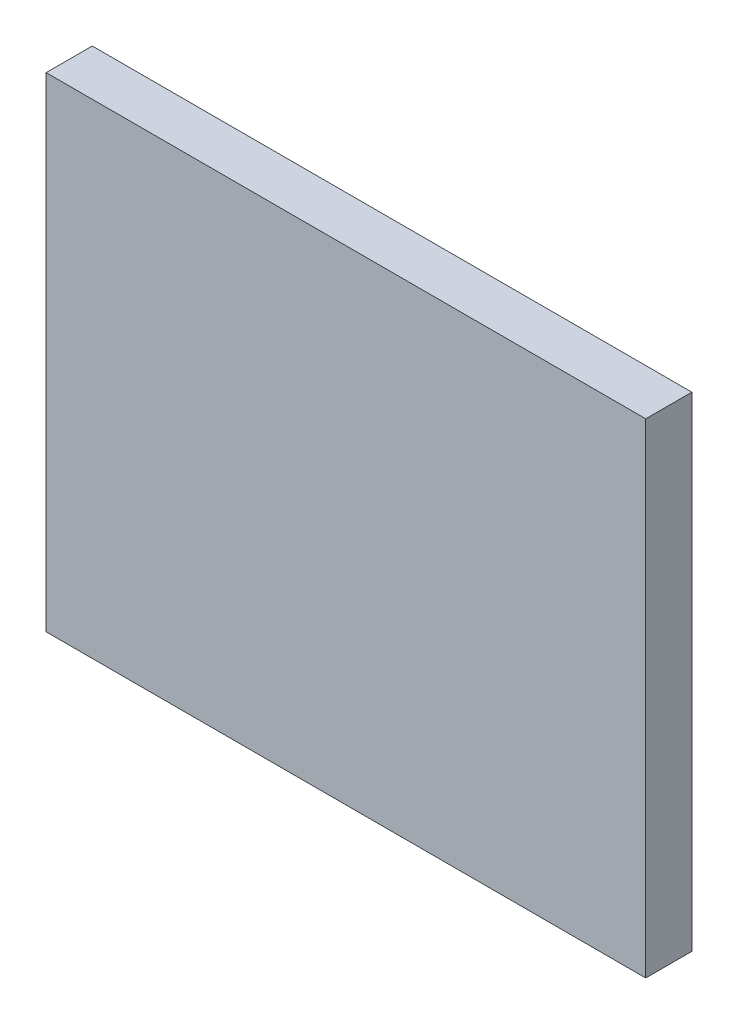
from build123d import *

# Parameters (mm, degrees)
ESQUISSE1_W        = 130
ESQUISSE1_H        = 105
BOSS_EXTRU_1_DEPTH = 10


with BuildPart() as part:
    # Esquisse1 → Boss.-Extru.1 (new body)
    with BuildSketch(Plane.XY):
        with Locations((-10.157559358, -21.543296089)):
            Rectangle(ESQUISSE1_W, ESQUISSE1_H)
    extrude(amount=BOSS_EXTRU_1_DEPTH)


solid = part.part
